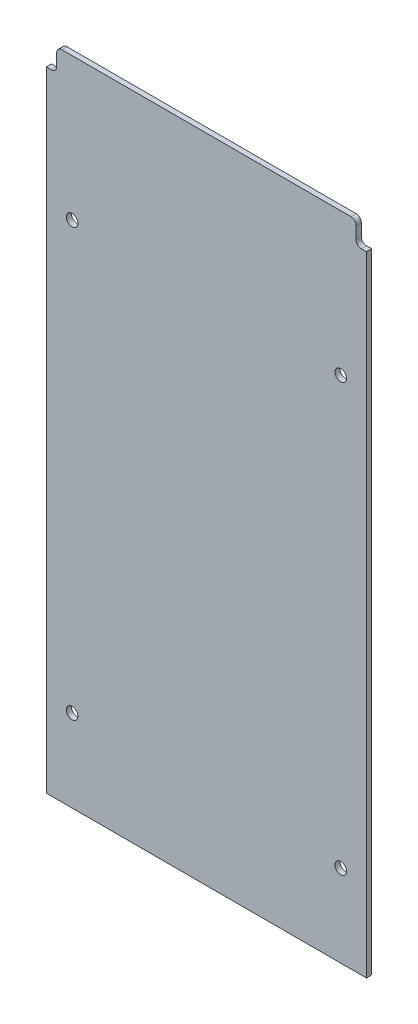
from build123d import *

# Parameters (mm, degrees)
SKETCH1_W               = 197.5866
SKETCH1_H               = 402.272499995
BOSS_EXTRUDE1_DEPTH     = 3.175
SKETCH3_W               = 6.35
SKETCH3_H               = 13.97
CUT_EXTRUDE1_DEPTH      = 459.355390558
FILLET1_R               = 3.175
F_1_4_CLEARANCE_HOLE1_D = 7.14248


with BuildPart() as part:
    # Sketch1 → Boss-Extrude1 (new body)
    with BuildSketch(Plane.XY):
        with Locations((182.40375, -160.813750003)):
            Rectangle(SKETCH1_W, SKETCH1_H)
    extrude(amount=BOSS_EXTRUDE1_DEPTH)

    # Sketch3 → Cut-Extrude1 (cut, through all)
    with BuildSketch(Plane.XY.offset(3.175)):
        with Locations((86.78545, 33.337499995)):
            Rectangle(SKETCH3_W, SKETCH3_H)
        with Locations((278.02205, 33.337499995)):
            Rectangle(SKETCH3_W, SKETCH3_H)
    extrude(amount=-CUT_EXTRUDE1_DEPTH, mode=Mode.SUBTRACT)

    # Fillet1
    fillet1_edges = [part.edges().sort_by_distance(p)[0] for p in [
        (89.96045, 40.322499995, 1.5875),
        (89.96045, 26.352499995, 1.5875),
        (274.84705, 26.352499995, 1.5875),
        (274.84705, 40.322499995, 1.5875),
    ]]
    fillet(fillet1_edges, radius=FILLET1_R)

    # 1/4 Clearance Hole1 (through all)
    with Locations(Plane.XY.offset(3.175)):
        with Locations((99.485400307, -47.621943918), (265.32205, -47.625), (265.32205, -311.15), (99.485499692, -311.146943918)):
            Hole(F_1_4_CLEARANCE_HOLE1_D / 2)


solid = part.part
